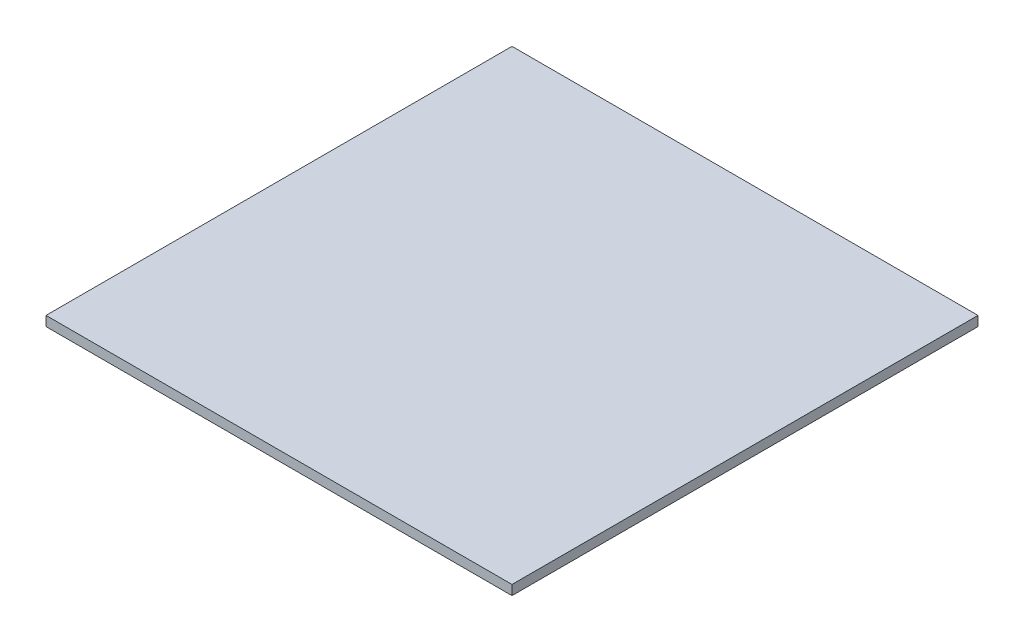
from build123d import *

# Parameters (mm, degrees)
SKETCH1_W           = 96
SKETCH1_H           = 96
BOSS_EXTRUDE1_DEPTH = 2


with BuildPart() as part:
    # Sketch1 → Boss-Extrude1 (new body)
    with BuildSketch(Plane(origin=(0, 0, 0), x_dir=(1, 0, 0), z_dir=(0, 1, 0))):
        Rectangle(SKETCH1_W, SKETCH1_H)
    extrude(amount=BOSS_EXTRUDE1_DEPTH)


solid = part.part
